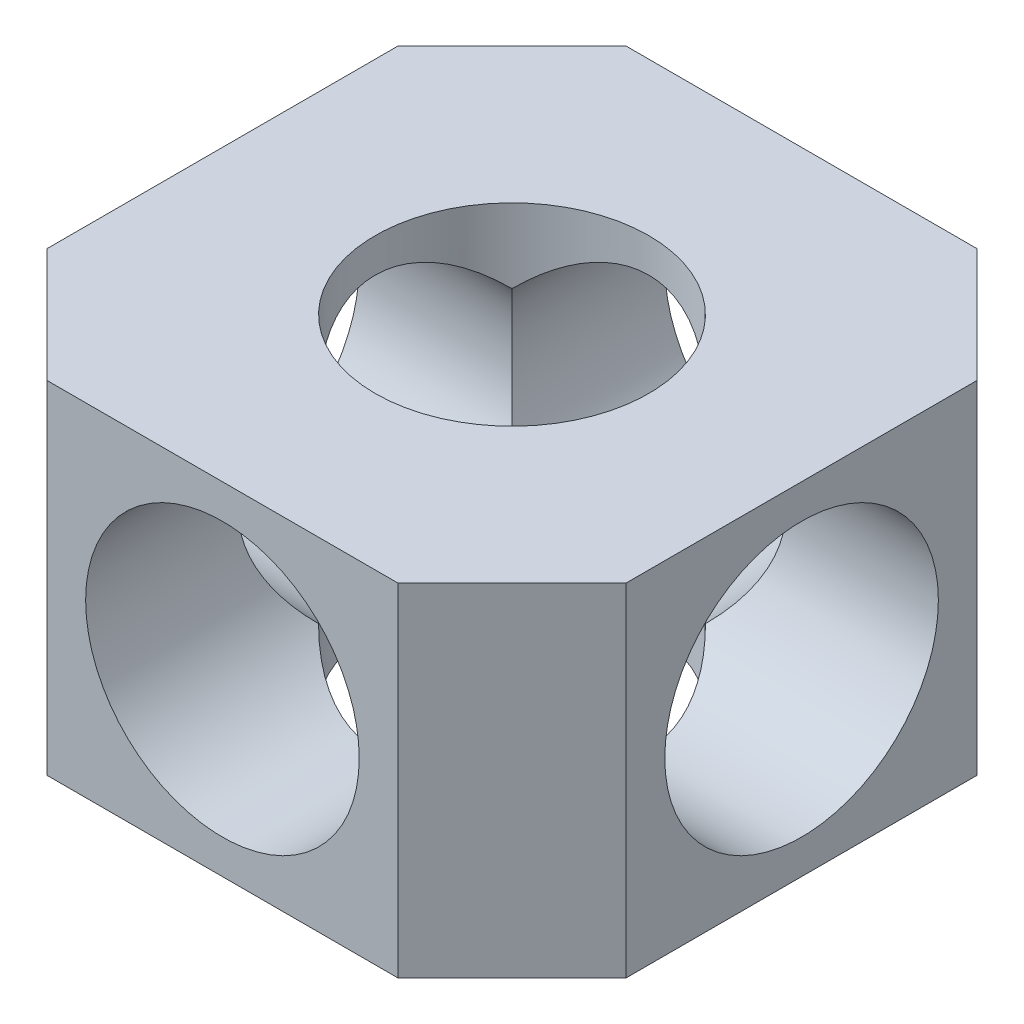
from build123d import *

# Parameters (mm, degrees)
SKETCH1_W           = 25.4
SKETCH1_H           = 25.4
BOSS_EXTRUDE1_DEPTH = 7.5
HOLE1_D             = 12
HOLE2_D             = 12
HOLE3_D             = 12
CHAMFER1_SIZE       = 5


with BuildPart() as part:
    # Sketch1 → Boss-Extrude1 (new, symmetric)
    with BuildSketch(Plane(origin=(0, 0, 0), x_dir=(1, 0, 0), z_dir=(0, 1, 0))):
        Rectangle(SKETCH1_W, SKETCH1_H)
    extrude(amount=BOSS_EXTRUDE1_DEPTH, both=True)

    # Hole1 (through all)
    with Locations(Plane(origin=(0, 7.5, 0), x_dir=(1, 0, 0), z_dir=(0, 1, 0))):
        with Locations((0, 0)):
            Hole(HOLE1_D / 2)

    # Hole2 (through all)
    with Locations(Plane.XY.offset(12.7)):
        with Locations((0, 0)):
            Hole(HOLE2_D / 2)

    # Hole3 (through all)
    with Locations(Plane(origin=(12.7, 0, 0), x_dir=(0, 0, -1), z_dir=(1, 0, 0))):
        with Locations((0, 0)):
            Hole(HOLE3_D / 2)

    # Chamfer1
    chamfer1_edges = [part.edges().sort_by_distance(p)[0] for p in [
        (-12.7, 0, -12.7),
        (12.7, 0, -12.7),
        (12.7, 0, 12.7),
        (-12.7, 0, 12.7),
    ]]
    chamfer(chamfer1_edges, length=CHAMFER1_SIZE)


solid = part.part
